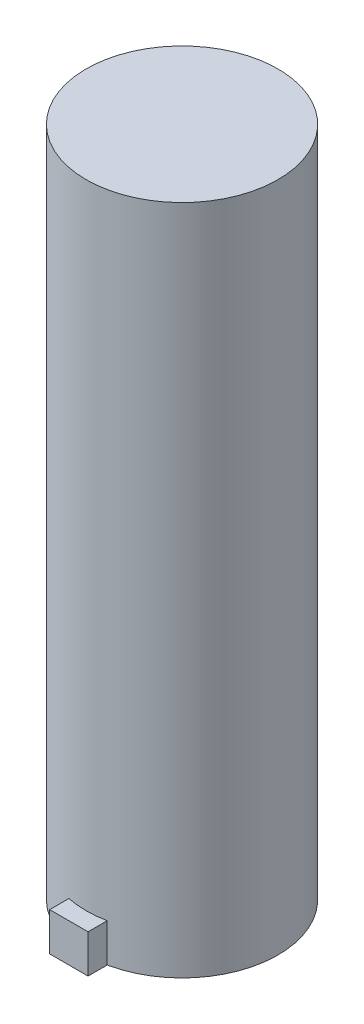
from build123d import *

# Parameters (mm, degrees)
SKETCH1_W           = 10
SKETCH1_H           = 70
BOSS_EXTRUDE1_DEPTH = 4


with BuildPart() as part:
    # Sketch1 → Revolve1 (revolve)
    with BuildSketch(Plane.XY, mode=Mode.PRIVATE) as revolve1_sk:
        with Locations((5, 35)):
            Rectangle(SKETCH1_W, SKETCH1_H)
    revolve(revolve1_sk.sketch.rotate(Axis((0, 70, 0), (0, -1, 0)), 90), axis=Axis((0, 70, 0), (0, -1, 0)))


with BuildPart() as body_2:
    # Sketch2 → Boss-Extrude1 (new body)
    with BuildSketch(Plane.XZ):
        with BuildLine():
            Line((-2, 11.797958971), (-2, 9.797958971))
            ThreePointArc((-2, 9.797958971), (0, 10), (2, 9.797958971))
            Line((2, 9.797958971), (2, 11.797958971))
            Line((2, 11.797958971), (-2, 11.797958971))
        make_face()
    extrude(amount=-BOSS_EXTRUDE1_DEPTH)


solid = Compound([part.part, body_2.part])
